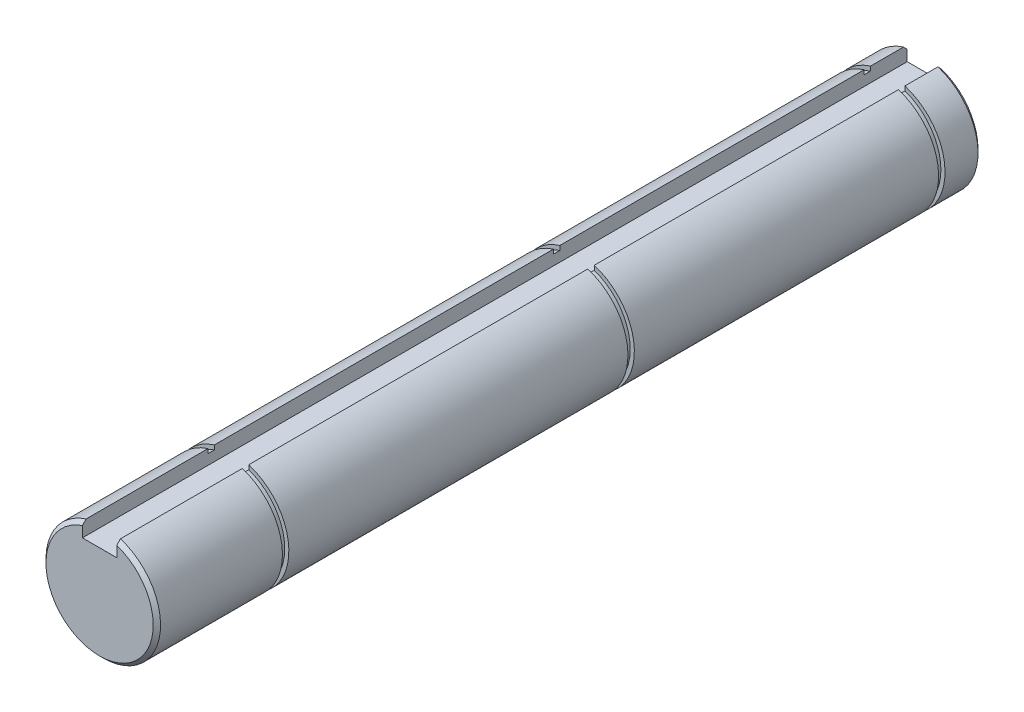
from build123d import *

# Parameters (mm, degrees)
BOSS_EXTRUDE1_DEPTH = 114.3
CHAMFER1_SIZE       = 0.508
SKETCH2_R           = 8.697781756
SKETCH2_R_2         = 7.366
CUT_EXTRUDE1_DEPTH  = 0.889
SKETCH3_OUTSIDE_W   = 41.162
SKETCH3_OUTSIDE_H   = 40.796
SKETCH3_OUTSIDE_R   = 7.366
CUT_EXTRUDE2_DEPTH  = 0.889
SKETCH4_OUTSIDE_W   = 41.162
SKETCH4_OUTSIDE_H   = 40.796
SKETCH4_OUTSIDE_R   = 7.366
CUT_EXTRUDE3_DEPTH  = 0.889


with BuildPart() as part:
    # Sketch1 → Boss-Extrude1 (new body)
    with BuildSketch(Plane.XY):
        with BuildLine():
            ThreePointArc((7.9375, 0), (6.399417088, 4.695888328), (2.38125, 7.571892411))
            Line((2.38125, 7.571892411), (2.38125, 5.55625))
            Line((2.38125, 5.55625), (-2.38125, 5.55625))
            Line((-2.38125, 5.55625), (-2.38125, 7.571892411))
            ThreePointArc((-2.38125, 7.571892411), (-4.695888328, -6.399417088), (7.9375, 0))
        make_face()
    extrude(amount=BOSS_EXTRUDE1_DEPTH)

    # Chamfer1
    chamfer1_edges = [part.edges().sort_by_distance(p)[0] for p in [
        (-4.695888328, -6.399417088, 0),
        (-4.695888328, -6.399417088, 114.3),
    ]]
    chamfer(chamfer1_edges, length=CHAMFER1_SIZE)

    # Sketch2 → Cut-Extrude1 (cut)
    with BuildSketch(Plane(origin=(0, 0, 5.08), x_dir=(-1, 0, 0), z_dir=(0, 0, -1))):
        Circle(SKETCH2_R)
        Circle(SKETCH2_R_2, mode=Mode.SUBTRACT)
    extrude(amount=-CUT_EXTRUDE1_DEPTH, mode=Mode.SUBTRACT)

    # Sketch3 outside → Cut-Extrude2 (cut)
    with BuildSketch(Plane.XY.offset(49.022)):
        with Locations((0, -0.183)):
            Rectangle(SKETCH3_OUTSIDE_W, SKETCH3_OUTSIDE_H)
        Circle(SKETCH3_OUTSIDE_R, mode=Mode.SUBTRACT)
    extrude(amount=-CUT_EXTRUDE2_DEPTH, mode=Mode.SUBTRACT)

    # Sketch4 outside → Cut-Extrude3 (cut)
    with BuildSketch(Plane.XY.offset(96.901)):
        with Locations((0, -0.183)):
            Rectangle(SKETCH4_OUTSIDE_W, SKETCH4_OUTSIDE_H)
        Circle(SKETCH4_OUTSIDE_R, mode=Mode.SUBTRACT)
    extrude(amount=-CUT_EXTRUDE3_DEPTH, mode=Mode.SUBTRACT)


solid = part.part
